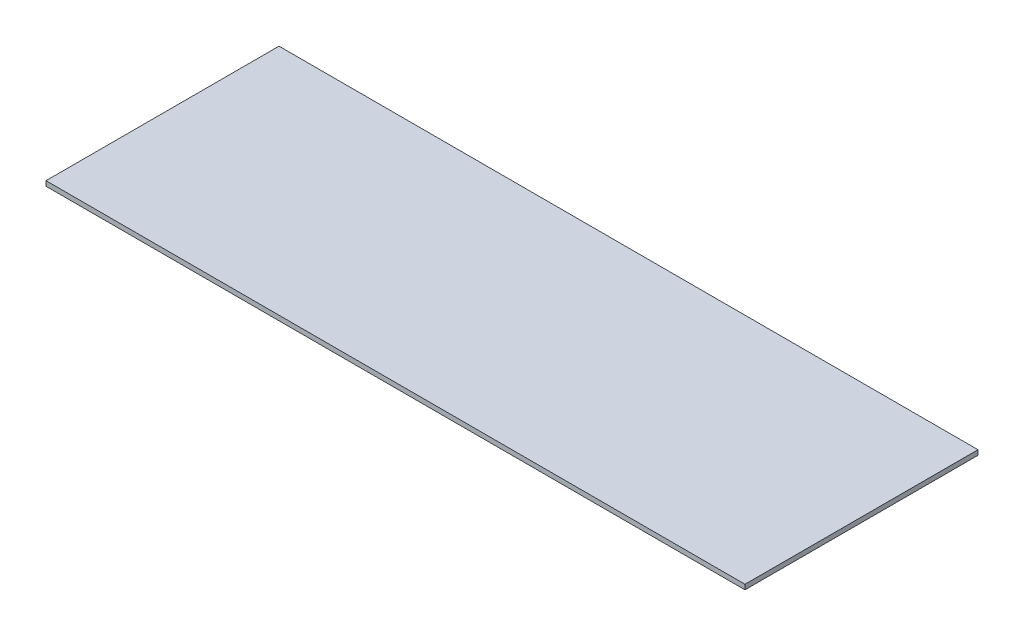
from build123d import *

# Parameters (mm, degrees)
SKETCH1_W           = 457.2
SKETCH1_H           = 152.4
BOSS_EXTRUDE1_DEPTH = 3.175


with BuildPart() as part:
    # Sketch1 → Boss-Extrude1 (new body)
    with BuildSketch(Plane(origin=(0, 0, 0), x_dir=(1, 0, 0), z_dir=(0, 1, 0))):
        with Locations((228.6, 76.2)):
            Rectangle(SKETCH1_W, SKETCH1_H)
    extrude(amount=BOSS_EXTRUDE1_DEPTH)


solid = part.part
